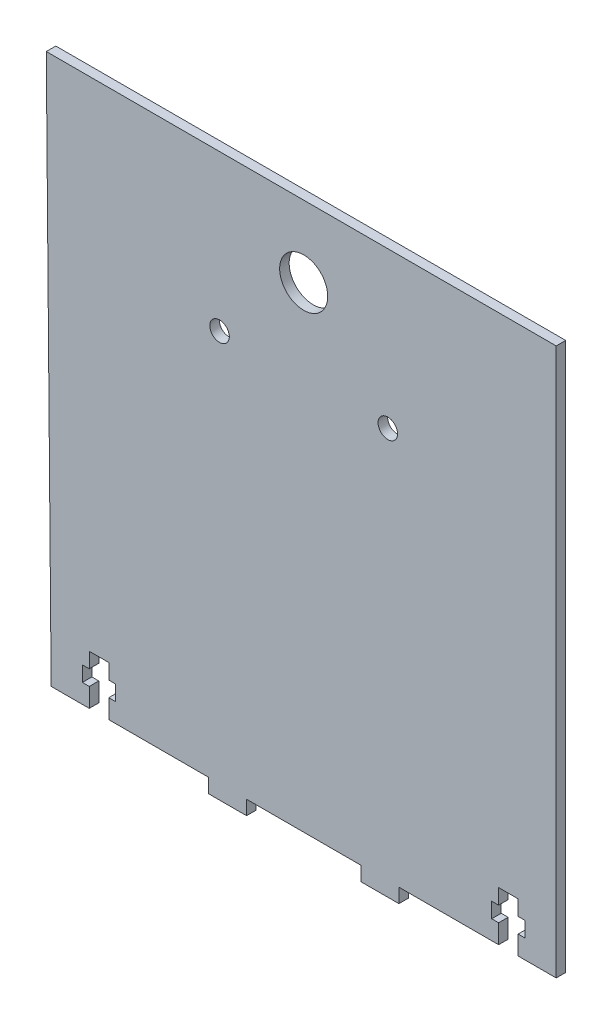
from build123d import *

# Parameters (mm, degrees)
SKETCH_1_R      = 5.05
SKETCH_1_R_2    = 2.05
EXTRUDE_1_DEPTH = 2


with BuildPart() as part:
    # 草图1 → 凸台-拉伸1 (new body)
    with BuildSketch(Plane.XY):
        Polygon((-40.741188564, 3.13029316), (-40.741188564, 7.13029316), (-39.291188564, 7.13029316), (-39.291188564, 10.33029316), (-40.741188564, 10.33029316), (-40.741188564, 13.53029316), (-44.841188564, 13.53029316), (-44.841188564, 10.33029316), (-46.291188564, 10.33029316), (-46.291188564, 7.13029316), (-44.841188564, 7.13029316), (-44.841188564, 3.13029316), (-52.841188564, 3.13029316), (-53.870849739, 118.13029316), (43.582829756, 118.13029316), (53.258811436, 118.13029316), (53.258811436, 3.13029316), (45.258811436, 3.13029316), (45.258811436, 7.13029316), (46.708811436, 7.13029316), (46.708811436, 10.33029316), (45.258811436, 10.33029316), (45.258811436, 13.53029316), (41.158811436, 13.53029316), (41.158811436, 10.33029316), (39.708811436, 10.33029316), (39.708811436, 7.13029316), (41.158811436, 7.13029316), (41.158811436, 3.13029316), (20.208811436, 3.13029316), (20.208811436, 0.13029316), (12.208811436, 0.13029316), (12.208811436, 3.13029316), (-11.791188564, 3.13029316), (-11.791188564, 0.13029316), (-19.791188564, 0.13029316), (-19.791188564, 3.13029316), align=None)
        with Locations((0.208811436, 103.13029316)):
            Circle(SKETCH_1_R, mode=Mode.SUBTRACT)
        with Locations((17.886480965, 85.45262363)):
            Circle(SKETCH_1_R_2, mode=Mode.SUBTRACT)
        with Locations(Location((-17.468858094, 85.45262363, 0), (0, 0, 180))):
            Circle(SKETCH_1_R_2, mode=Mode.SUBTRACT)
    extrude(amount=EXTRUDE_1_DEPTH)


solid = part.part
